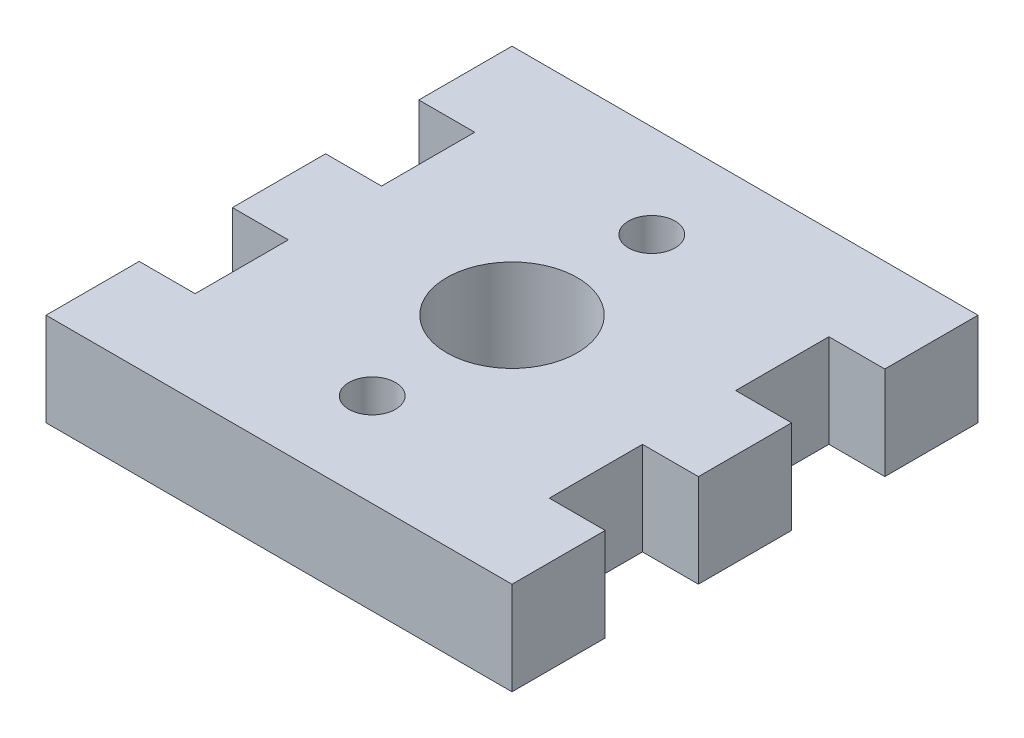
from build123d import *

# Parameters (mm, degrees)
SKETCH1_W           = 25
SKETCH1_H           = 25
SKETCH1_R           = 3.5
BOSS_EXTRUDE1_DEPTH = 5
SKETCH2_W           = 3
SKETCH2_H           = 5
CUT_EXTRUDE1_DEPTH  = 15
SKETCH3_R           = 1.25
SKETCH3_R_2         = 3.402319191
CUT_EXTRUDE2_DEPTH  = 5


with BuildPart() as part:
    # Sketch1 → Boss-Extrude1 (new body)
    with BuildSketch(Plane(origin=(0, 0, 0), x_dir=(1, 0, 0), z_dir=(0, 1, 0))):
        with Locations((1.342975207, -1.859504132)):
            Rectangle(SKETCH1_W, SKETCH1_H)
        with Locations(Location((1.342975207, -1.859504132, 0), (0, 0, 270))):
            Circle(SKETCH1_R, mode=Mode.SUBTRACT)
    extrude(amount=BOSS_EXTRUDE1_DEPTH)

    # Sketch2 → Cut-Extrude1 (cut)
    with BuildSketch(Plane(origin=(0, 5, 0), x_dir=(1, 0, 0), z_dir=(0, 1, 0))):
        with Locations((-9.657024793, 3.140495868)):
            Rectangle(SKETCH2_W, SKETCH2_H)
        with Locations((-9.657024793, -6.859504132)):
            Rectangle(SKETCH2_W, SKETCH2_H)
        with Locations((12.342975207, -6.859504132)):
            Rectangle(SKETCH2_W, SKETCH2_H)
        with Locations((12.342975207, 3.140495868)):
            Rectangle(SKETCH2_W, SKETCH2_H)
    extrude(amount=-CUT_EXTRUDE1_DEPTH, mode=Mode.SUBTRACT)

    # Sketch3 → Cut-Extrude2 (cut)
    with BuildSketch(Plane(origin=(0, 5, 0), x_dir=(1, 0, 0), z_dir=(0, 1, 0))):
        with Locations(Location((1.342975207, 5.640495868, 0), (0, 0, 270))):
            Circle(SKETCH3_R)
        with Locations(Location((1.342975207, -9.359504132, 0), (0, 0, 270))):
            Circle(SKETCH3_R)
        with Locations((1.342975207, -1.859504132)):
            Circle(SKETCH3_R_2)
    extrude(amount=-CUT_EXTRUDE2_DEPTH, mode=Mode.SUBTRACT)


solid = part.part
